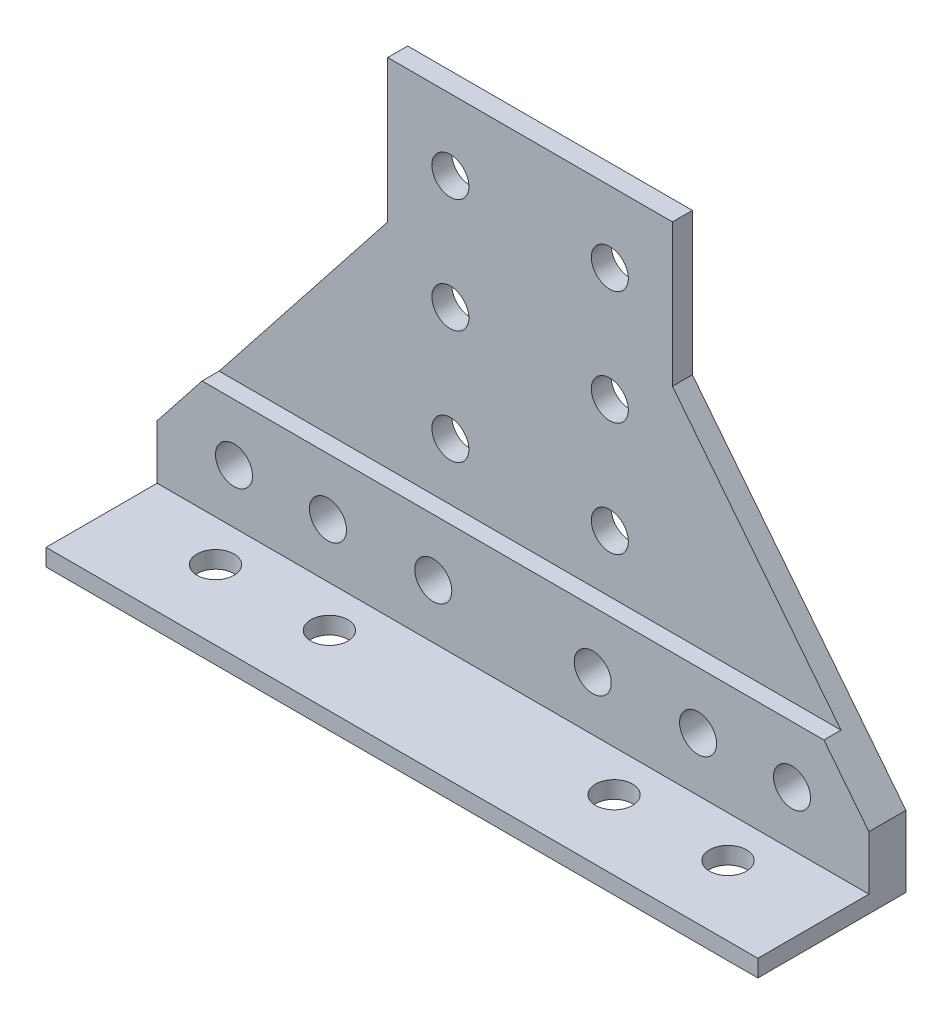
from build123d import *

# Parameters (mm, degrees)
EXTRUDE_1_DEPTH          = 14
SKETCH_3_R               = 13
CUT_EXTRUDE_1_DEPTH      = 423.251110123
PATTERN_LINEAR_1_COUNT   = 3
PATTERN_LINEAR_1_PITCH   = 80
MIRROR_1_COPY_1_SKETCH_R = 13
MIRROR_1_COPY_1_DEPTH    = 423.251110123
MIRROR_1_COPY_2_SKETCH_R = 13
MIRROR_1_COPY_2_DEPTH    = 423.251110123
EXTRUDE_2_DEPTH          = 12
SKETCH_7_R               = 13
CUT_EXTRUDE_2_DEPTH      = 423.819110259
SKETCH_8_W               = 500
SKETCH_8_H               = 12
EXTRUDE_5_DEPTH          = 78
SKETCH_9_R               = 13
CUT_EXTRUDE_3_DEPTH      = 435.644682471


with BuildPart() as part:
    # 草图1 → 凸台-拉伸1 (new body)
    with BuildSketch(Plane.XY):
        Polygon((0, 0), (250, 0), (250, 50), (100, 240), (100, 340), (0, 340), (-100, 340), (-100, 240), (-250, 50), (-250, 0), align=None)
    extrude(amount=EXTRUDE_1_DEPTH)

    # 草图3 → 切除-拉伸1 (cut, through all)
    with BuildSketch(Plane.XY.offset(14)):
        with Locations((-56, 290)):
            Circle(SKETCH_3_R)
    cut_extrude_1 = extrude(amount=-CUT_EXTRUDE_1_DEPTH, mode=Mode.SUBTRACT)

    # 阵列(线性)1: 切除-拉伸1 ×3
    with Locations(*[(0, -i * PATTERN_LINEAR_1_PITCH, 0) for i in range(1, PATTERN_LINEAR_1_COUNT)]):
        add(cut_extrude_1, mode=Mode.SUBTRACT)

    # 镜向1: 切除-拉伸1 across plane
    add(cut_extrude_1.mirror(Plane(origin=(0, 0, 0), x_dir=(0, 0, 1), z_dir=(1, 0, 0))), mode=Mode.SUBTRACT)

    # 镜向1 copy 1 sketch → 镜向1 copy 1 (cut, through all)
    with BuildSketch(Plane(origin=(0, -80, 14), x_dir=(-1, 0, 0), z_dir=(0, 0, 1))):
        with Locations((-56, -290)):
            Circle(MIRROR_1_COPY_1_SKETCH_R)
    extrude(amount=-MIRROR_1_COPY_1_DEPTH, mode=Mode.SUBTRACT)

    # 镜向1 copy 2 sketch → 镜向1 copy 2 (cut, through all)
    with BuildSketch(Plane(origin=(0, -160, 14), x_dir=(-1, 0, 0), z_dir=(0, 0, 1))):
        with Locations((-56, -290)):
            Circle(MIRROR_1_COPY_2_SKETCH_R)
    extrude(amount=-MIRROR_1_COPY_2_DEPTH, mode=Mode.SUBTRACT)

    # 草图6 → 凸台-拉伸2 (add)
    with BuildSketch(Plane.XY.offset(14)):
        Polygon((218.421052632, 90), (-218.421052632, 90), (-250, 50), (-250, 0), (250, 0), (250, 50), align=None)
    extrude(amount=EXTRUDE_2_DEPTH)

    # 草图7 → 切除-拉伸2 (cut, through all)
    with BuildSketch(Plane.XY.offset(26)):
        with Locations((-56, 50)):
            Circle(SKETCH_7_R)
        with Locations((-130, 50)):
            Circle(SKETCH_7_R)
        with Locations((-196, 50)):
            Circle(SKETCH_7_R)
    cut_extrude_2 = extrude(amount=-CUT_EXTRUDE_2_DEPTH, mode=Mode.SUBTRACT)

    # 镜向2: 切除-拉伸2 across plane
    add(cut_extrude_2.mirror(Plane(origin=(0, 0, 0), x_dir=(0, 0, 1), z_dir=(1, 0, 0))), mode=Mode.SUBTRACT)

    # 草图8 → 凸台-拉伸5 (add)
    with BuildSketch(Plane.XY.offset(26)):
        with Locations((0, 6)):
            Rectangle(SKETCH_8_W, SKETCH_8_H)
    extrude(amount=EXTRUDE_5_DEPTH)

    # 草图9 → 切除-拉伸3 (cut, through all)
    with BuildSketch(Plane.XZ):
        with Locations(Location((-180, 55, 0), (0, 0, 270))):
            Circle(SKETCH_9_R)
        with Locations(Location((-100, 55, 0), (0, 0, 270))):
            Circle(SKETCH_9_R)
    cut_extrude_3 = extrude(amount=-CUT_EXTRUDE_3_DEPTH, mode=Mode.SUBTRACT)

    # 镜向3: 切除-拉伸3 across plane
    add(cut_extrude_3.mirror(Plane(origin=(0, 0, 0), x_dir=(0, 0, 1), z_dir=(1, 0, 0))), mode=Mode.SUBTRACT)


solid = part.part
